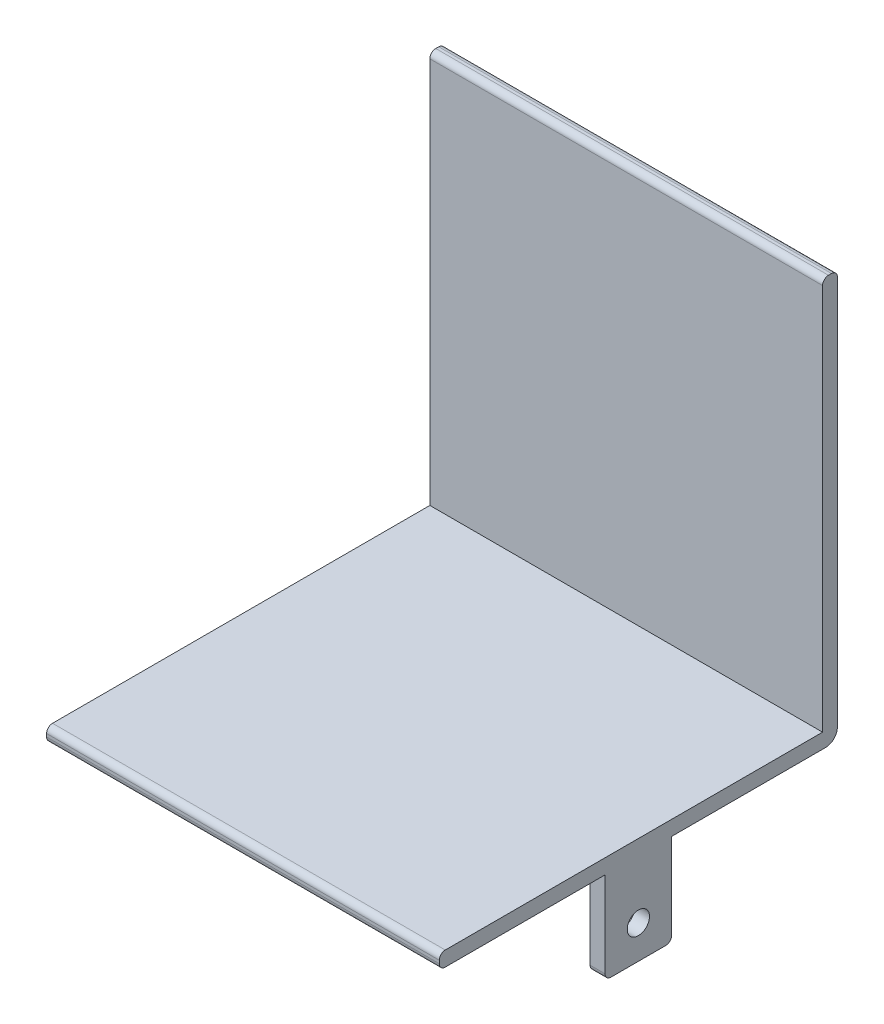
from build123d import *

# Parameters (mm, degrees)
BOSS_EXTRUDE5_DEPTH = 84.074
SKETCH12_R          = 2.38125
BOSS_EXTRUDE6_DEPTH = 3.175


with BuildPart() as part:
    # Sketch11 → Boss-Extrude5 (new body)
    with BuildSketch(Plane(origin=(0, 0, 0), x_dir=(0, 0, -1), z_dir=(1, 0, 0))):
        with BuildLine():
            Line((0, 2.54), (0, 85.979))
            ThreePointArc((0, 85.979), (-0.371974388, 86.877025612), (-1.27, 87.249))
            Line((-1.27, 87.249), (-1.905, 87.249))
            ThreePointArc((-1.905, 87.249), (-2.803025612, 86.877025612), (-3.175, 85.979))
            Line((-3.175, 85.979), (-3.175, 3.175))
            Line((-3.175, 3.175), (-83.947, 3.175))
            ThreePointArc((-83.947, 3.175), (-84.845025612, 2.803025612), (-85.217, 1.905))
            Line((-85.217, 1.905), (-85.217, 1.27))
            ThreePointArc((-85.217, 1.27), (-84.845025612, 0.371974388), (-83.947, 0))
            Line((-83.947, 0), (-2.54, 0))
            ThreePointArc((-2.54, 0), (-0.743948776, 0.743948776), (0, 2.54))
        make_face()
    extrude(amount=BOSS_EXTRUDE5_DEPTH)

    # Sketch12 → Boss-Extrude6 (add)
    with BuildSketch(Plane(origin=(84.074, 0, 0), x_dir=(0, 0, -1), z_dir=(1, 0, 0))):
        with BuildLine():
            Line((-49.75225, -18.328132), (-49.75225, 0))
            Line((-49.75225, 0), (-35.46475, 0))
            Line((-35.46475, 0), (-35.46475, -18.328132))
            ThreePointArc((-35.46475, -18.328132), (-35.836724388, -19.226157612), (-36.73475, -19.598132))
            Line((-36.73475, -19.598132), (-48.48225, -19.598132))
            ThreePointArc((-48.48225, -19.598132), (-49.380275612, -19.226157612), (-49.75225, -18.328132))
        make_face()
        with Locations((-42.6085, -12.454382)):
            Circle(SKETCH12_R, mode=Mode.SUBTRACT)
    extrude(amount=-BOSS_EXTRUDE6_DEPTH)


solid = part.part
